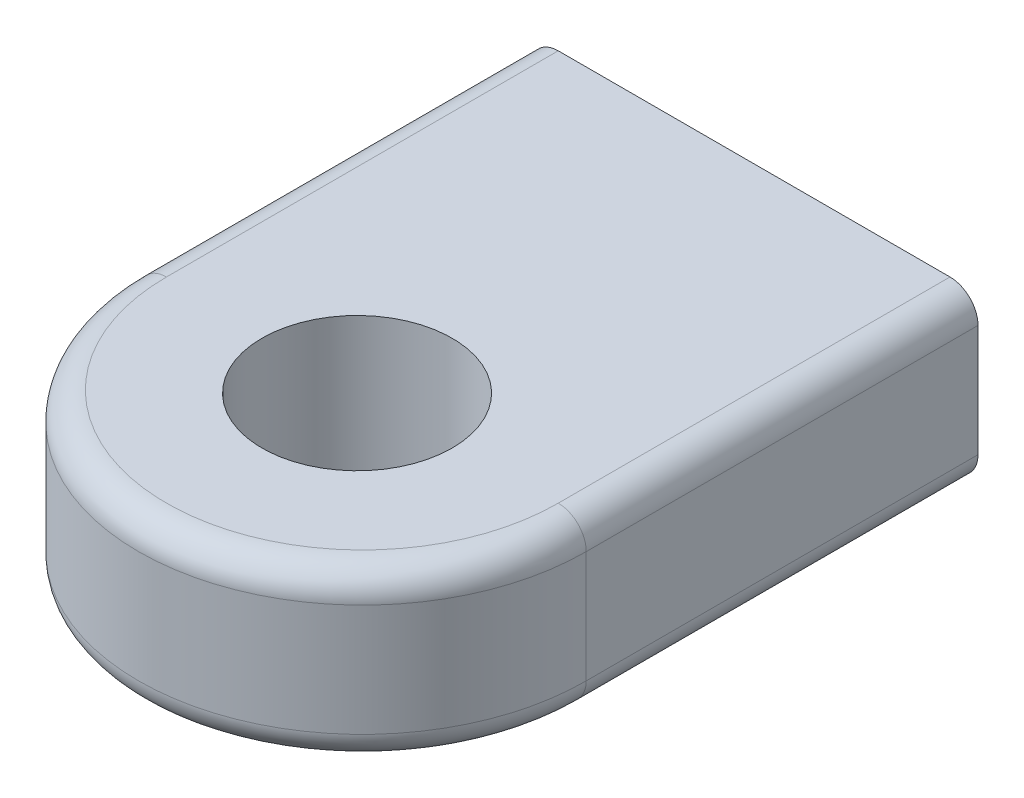
from build123d import *

# Parameters (mm, degrees)
SKETCH1_W           = 80
SKETCH1_H           = 30
BOSS_EXTRUDE1_DEPTH = 110
FILLET1_RADIUS      = 40
FILLET1_LENGTH      = 30
FILLET2_R           = 5
CUT_EXTRUDE1_REACH  = 122.83
SKETCH2_R           = 17


with BuildPart() as part:
    # Sketch1 → Boss-Extrude1 (new body)
    with BuildSketch(Plane.XY):
        with Locations((0, 15)):
            Rectangle(SKETCH1_W, SKETCH1_H)
    extrude(amount=BOSS_EXTRUDE1_DEPTH)

    # Fillet1: full round fillet: the end face becomes a half cylinder, R = half its width
    fillet1_face = Plane((0, 15, 110), x_dir=(0, -1, 0), z_dir=(0, 0, 1))  # on the end face: x along it, z out of the body
    fillet1_slab = fillet1_face.offset(-FILLET1_RADIUS / 2) * Box(FILLET1_LENGTH, 2 * FILLET1_RADIUS, FILLET1_RADIUS, mode=Mode.PRIVATE)  # the body's end, R deep
    fillet1_round = Plane((0, 15, 70), x_dir=(0, 0, 1), z_dir=(0, -1, 0)) * Cylinder(FILLET1_RADIUS, FILLET1_LENGTH, mode=Mode.PRIVATE)  # its axis R under the face
    add(fillet1_slab - fillet1_round, mode=Mode.SUBTRACT)

    # Fillet2
    fillet2_edges = [part.edges().sort_by_distance(p)[0] for p in [
        (40, 30, 35),
        (40, 0, 35),
        (-40, 0, 35),
        (-40, 30, 35),
        (0, 30, 110),
        (0, 0, 110),
    ]]
    fillet(fillet2_edges, radius=FILLET2_R)

    # Sketch2 → Cut-Extrude1 (cut, up to next)
    with BuildSketch(Plane.XZ, mode=Mode.PRIVATE) as cut_extrude1_sk1:
        with Locations((0, 70.95)):
            Circle(SKETCH2_R)
    cut_extrude1_tool1 = extrude(cut_extrude1_sk1.sketch, amount=-CUT_EXTRUDE1_REACH, mode=Mode.PRIVATE) & part.part
    add(cut_extrude1_tool1.solids().sort_by_distance((0, 0, 70.95))[0], mode=Mode.SUBTRACT)


solid = part.part
